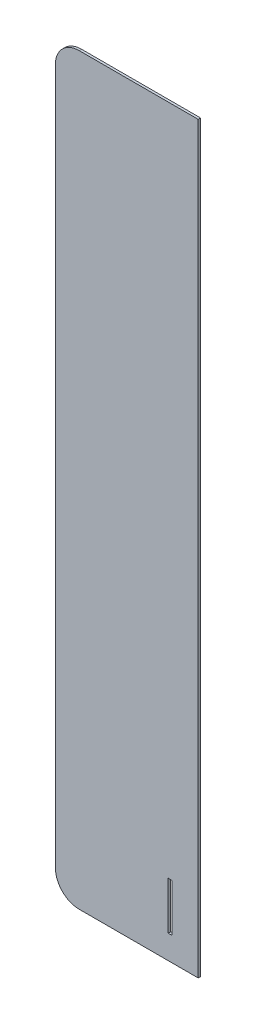
from build123d import *

# Parameters (mm, degrees)
SKETCH_1_W               = 300
SKETCH_1_H               = 1562
EXTRUDE_1_DEPTH          = 5
FILLET_1_R               = 50
CUT_EXTRUDE_1_DEPTH      = 796.289884256
CUT_EXTRUDE_1_DEPTH_BACK = 796.289884256
SKETCH_2_W               = 8
SKETCH_2_H               = 100


with BuildPart() as part:
    # Эскиз1 → Бобышка-Вытянуть1 (new body)
    with BuildSketch(Plane.XY):
        Rectangle(SKETCH_1_W, SKETCH_1_H)
    extrude(amount=EXTRUDE_1_DEPTH)

    # Скругление1
    fillet_1_edges = [part.edges().sort_by_distance(p)[0] for p in [
        (-150, -781, 2.5),
        (-150, 781, 2.5),
    ]]
    fillet(fillet_1_edges, radius=FILLET_1_R)

    # Эскиз2 → Вырез-Вытянуть1 (cut, two sides: drawn at the far end of the back side and taken through both)
    with BuildSketch(Plane.XY.offset(5).offset(-CUT_EXTRUDE_1_DEPTH_BACK)):
        with Locations((91, -681)):
            Rectangle(SKETCH_2_W, SKETCH_2_H)
    extrude(amount=CUT_EXTRUDE_1_DEPTH + CUT_EXTRUDE_1_DEPTH_BACK, mode=Mode.SUBTRACT)


solid = part.part
